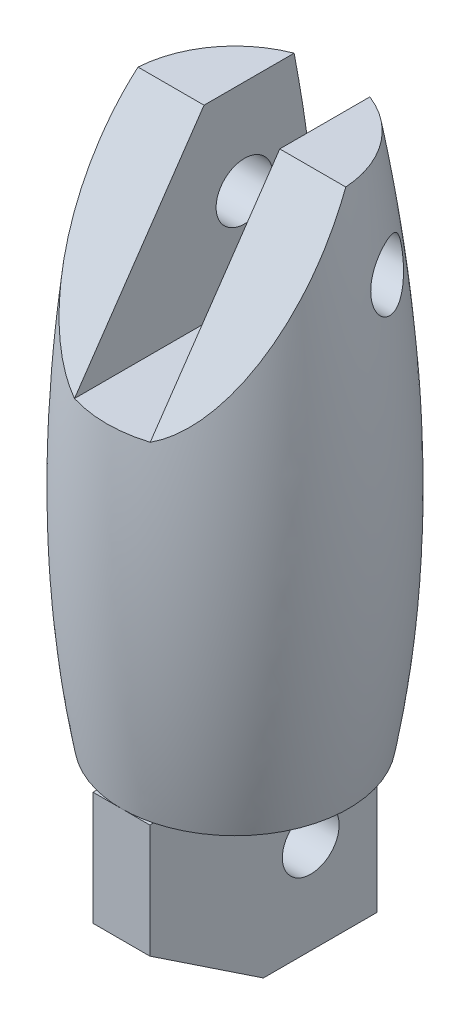
from build123d import *

# Parameters (mm, degrees)
SKETCH3_W               = 4
SKETCH3_H               = 10
CUT_EXTRUDE2_DEPTH      = 11.5
CUT_EXTRUDE3_DEPTH      = 30.711019541
CUT_EXTRUDE3_DEPTH_BACK = 30.711019541
BOSS_EXTRUDE1_DEPTH     = 1.5
CUT_EXTRUDE4_DEPTH      = 30.711019541
CUT_EXTRUDE4_DEPTH_BACK = 30.711019541
SKETCH5_R               = 1.5


with BuildPart() as part:
    # Sketch1 → Revolve1 (revolve)
    with BuildSketch(Plane(origin=(0, 0, 0), x_dir=(0, 0, -1), z_dir=(1, 0, 0))):
        with BuildLine():
            Line((0, 0), (0, 28))
            Line((0, 28), (5.5, 28))
            add(Edge.make_bspline(
                [(5.5, 28), (8.278370843, 12.243075952), (6, 0)],
                knots=[0, 0, 0, 1, 1, 1], degree=2))
            Line((6, 0), (0, 0))
        make_face()
    revolve(axis=Axis((0, 0, 0), (0, 1, 0)))

    # Sketch3 → Cut-Extrude2 (cut, symmetric)
    with BuildSketch(Plane.XY):
        with Locations((0, 23)):
            Rectangle(SKETCH3_W, SKETCH3_H)
    extrude(amount=CUT_EXTRUDE2_DEPTH, both=True, mode=Mode.SUBTRACT)

    # Sketch4 → Cut-Extrude3 (cut, two sides: drawn at the far end of the back side and taken through both)
    with BuildSketch(Plane(origin=(0, 0, 0), x_dir=(0, 0, -1), z_dir=(1, 0, 0)).offset(-CUT_EXTRUDE3_DEPTH_BACK)):
        Polygon((-6.781758395, 28), (-6.480142509, 18), (0.363394388, 28), align=None)
    extrude(amount=CUT_EXTRUDE3_DEPTH + CUT_EXTRUDE3_DEPTH_BACK, mode=Mode.SUBTRACT)

    # Sketch6 → Boss-Extrude1 (add, symmetric)
    with BuildSketch(Plane(origin=(0, 0, 0), x_dir=(0, 0, -1), z_dir=(1, 0, 0))):
        Polygon((-6, 0), (-6, -6), (0, -10), (6, -10), (6, 0), align=None)
    extrude(amount=BOSS_EXTRUDE1_DEPTH, both=True)

    # Sketch5 → Cut-Extrude4 (cut, two sides: drawn at the far end of the back side and taken through both)
    with BuildSketch(Plane(origin=(0, 0, 0), x_dir=(0, 0, -1), z_dir=(1, 0, 0)).offset(-CUT_EXTRUDE4_DEPTH_BACK)):
        with Locations((2.5, 23)):
            Circle(SKETCH5_R)
        with Locations(Location((2.5, -5, 0), (0, 0, 180))):
            Circle(SKETCH5_R)
    extrude(amount=CUT_EXTRUDE4_DEPTH + CUT_EXTRUDE4_DEPTH_BACK, mode=Mode.SUBTRACT)


solid = part.part
